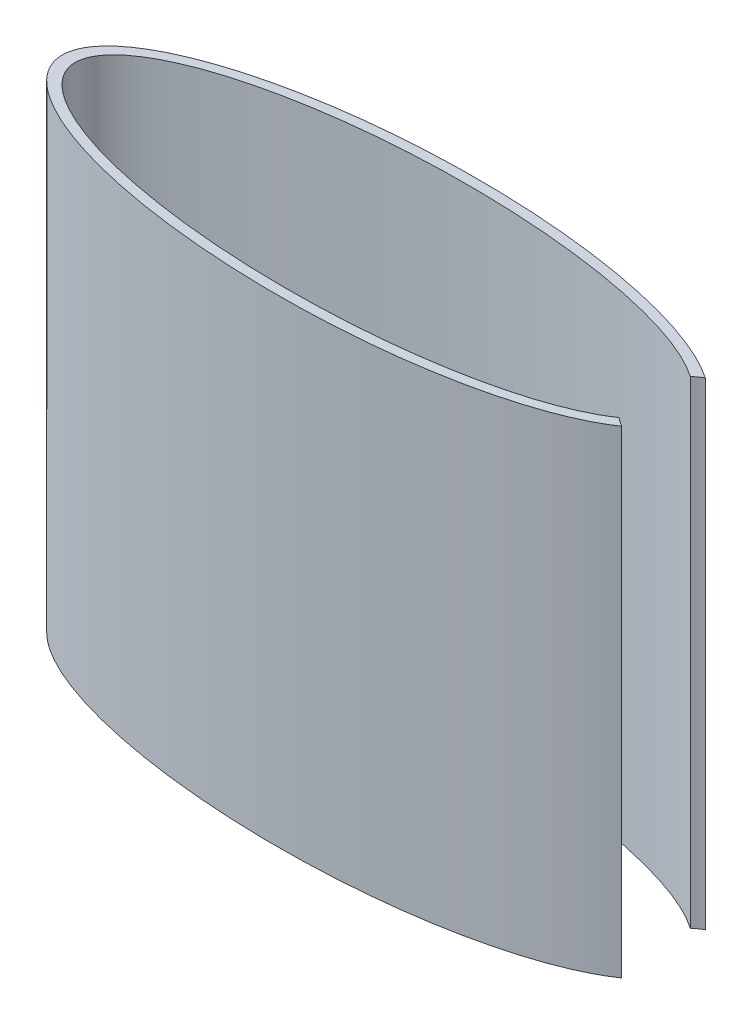
from build123d import *

# Parameters (mm, degrees)
SKETCH1_RX          = 83.867123974
SKETCH1_RY          = 26.715201139
SKETCH1_RX_2        = 80.411426315
SKETCH1_RY_2        = 24.05697217
BOSS_EXTRUDE1_DEPTH = 127.254
SKETCH2_R           = 12.695879526
CUT_EXTRUDE1_DEPTH  = 157.48


with BuildPart() as part:
    # Sketch1 → Boss-Extrude1 (new body)
    with BuildSketch(Plane(origin=(0, 0, 0), x_dir=(1, 0, 0), z_dir=(0, 1, 0))):
        with Locations((0, 0)):
            Ellipse(SKETCH1_RX, SKETCH1_RY)
        with Locations((0, 0)):
            Ellipse(SKETCH1_RX_2, SKETCH1_RY_2, mode=Mode.SUBTRACT)
    extrude(amount=BOSS_EXTRUDE1_DEPTH)

    # Sketch2 → Cut-Extrude1 (cut)
    with BuildSketch(Plane(origin=(0, 127.254, 0), x_dir=(1, 0, 0), z_dir=(0, 1, 0))):
        with Locations((82.362769104, 0)):
            Circle(SKETCH2_R)
    extrude(amount=-CUT_EXTRUDE1_DEPTH, mode=Mode.SUBTRACT)


solid = part.part
